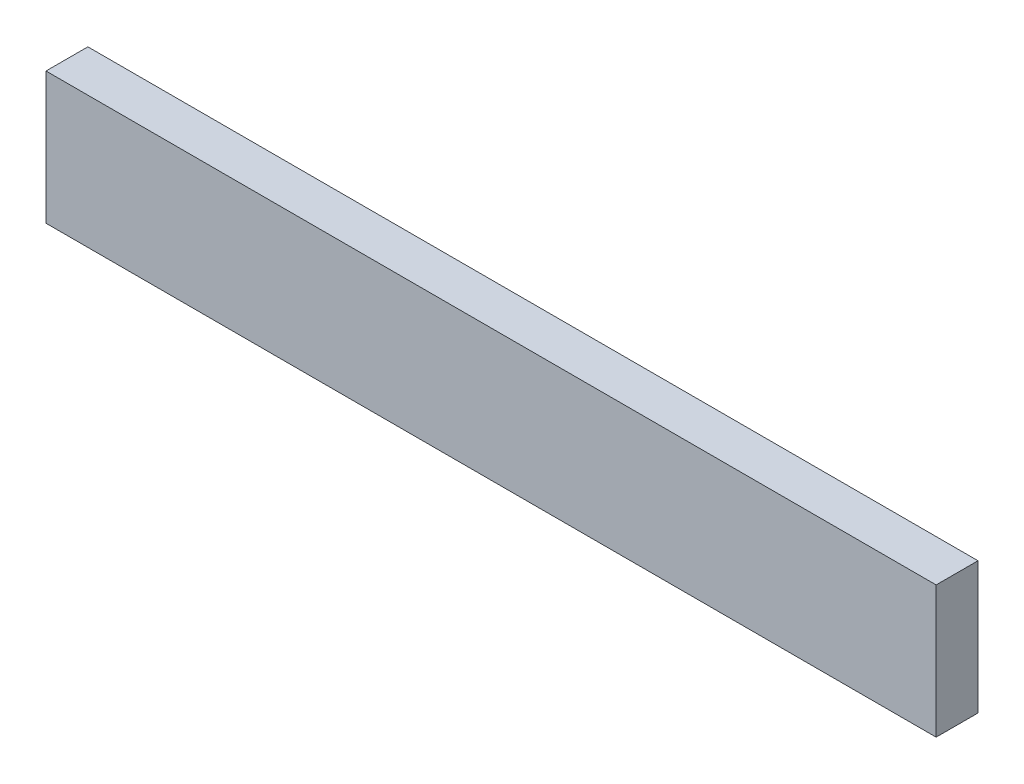
from build123d import *

# Parameters (mm, degrees)
SKETCH2_W           = 270
SKETCH2_H           = 40
BOSS_EXTRUDE1_DEPTH = 12.7


with BuildPart() as part:
    # Sketch2 → Boss-Extrude1 (new body)
    with BuildSketch(Plane.XY):
        Rectangle(SKETCH2_W, SKETCH2_H)
    extrude(amount=BOSS_EXTRUDE1_DEPTH)


solid = part.part
